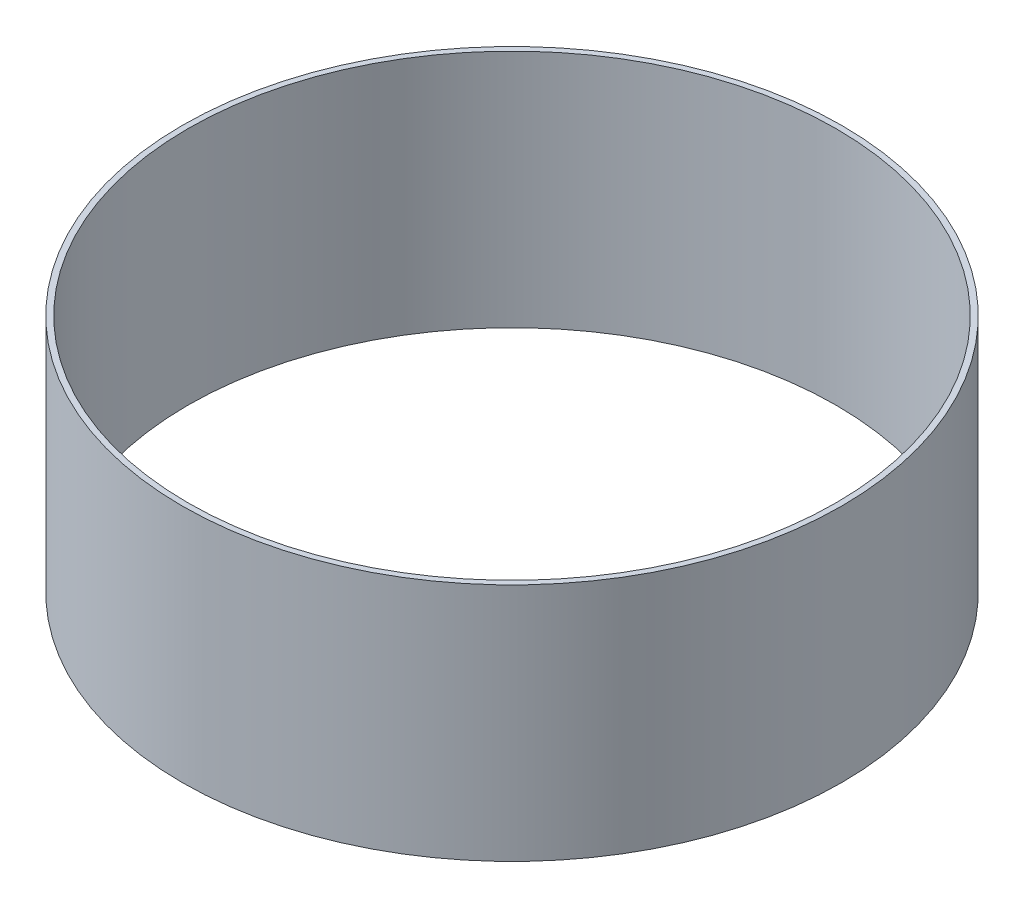
from build123d import *

# Parameters (mm, degrees)
SKETCH1_R           = 46.8
SKETCH1_R_2         = 46
BOSS_EXTRUDE1_DEPTH = 34


with BuildPart() as part:
    # Sketch1 → Boss-Extrude1 (new body)
    with BuildSketch(Plane(origin=(0, 0, 0), x_dir=(1, 0, 0), z_dir=(0, 1, 0))):
        with Locations(Location((0, 0, 0), (0, 0, 270))):
            Circle(SKETCH1_R)
        with Locations(Location((0, 0, 0), (0, 0, 270))):
            Circle(SKETCH1_R_2, mode=Mode.SUBTRACT)
    extrude(amount=BOSS_EXTRUDE1_DEPTH)


solid = part.part
